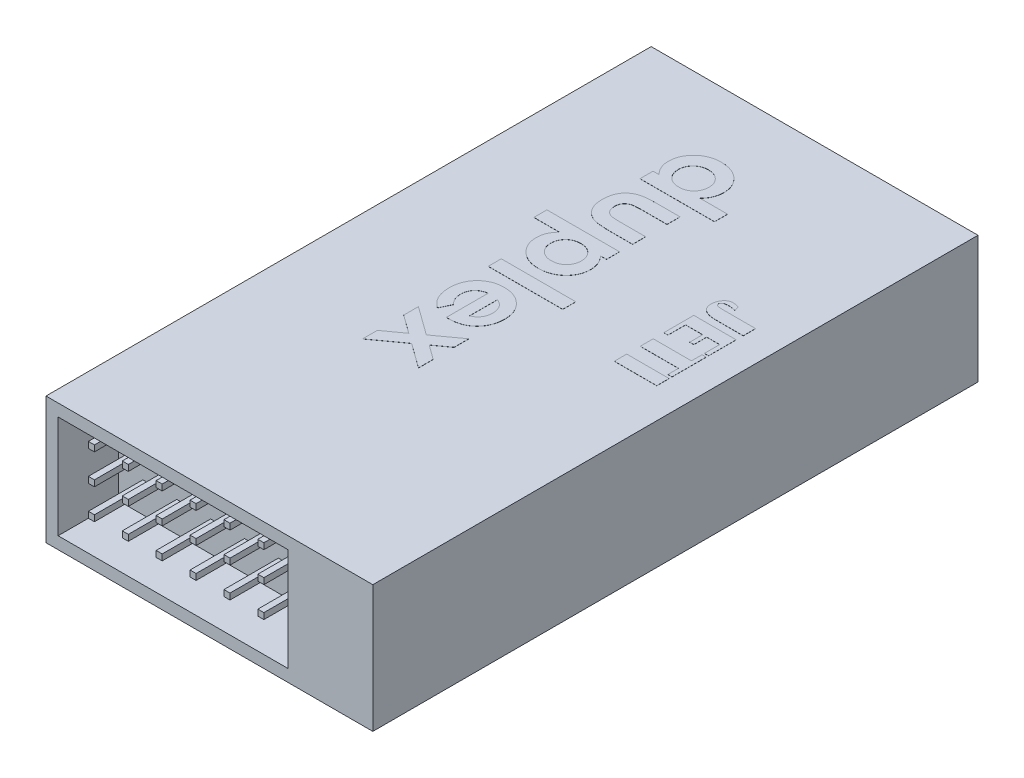
from build123d import *

# Parameters (mm, degrees)
SKETCH1_W                  = 27
SKETCH1_H                  = 50
BOSS_EXTRUDE1_DEPTH        = 10.5
SKETCH2_W                  = 19
SKETCH2_H                  = 8.5
CUT_EXTRUDE1_DEPTH         = 5
SKETCH3_W                  = 0.5
SKETCH3_H                  = 0.5
BOSS_EXTRUDE2_DEPTH        = 4.5
LPATTERN1_COUNT            = 3
LPATTERN1_PITCH            = 2.5
LPATTERN2_COUNT            = 6
LPATTERN2_PITCH            = 2.8
LPATTERN2_COPY_1_SKETCH_W  = 0.5
LPATTERN2_COPY_1_SKETCH_H  = 0.5
LPATTERN2_COPY_1_DEPTH     = 4.5
LPATTERN2_COPY_2_SKETCH_W  = 0.5
LPATTERN2_COPY_2_SKETCH_H  = 0.5
LPATTERN2_COPY_2_DEPTH     = 4.5
LPATTERN2_COPY_3_SKETCH_W  = 0.5
LPATTERN2_COPY_3_SKETCH_H  = 0.5
LPATTERN2_COPY_3_DEPTH     = 4.5
LPATTERN2_COPY_4_SKETCH_W  = 0.5
LPATTERN2_COPY_4_SKETCH_H  = 0.5
LPATTERN2_COPY_4_DEPTH     = 4.5
LPATTERN2_COPY_5_SKETCH_W  = 0.5
LPATTERN2_COPY_5_SKETCH_H  = 0.5
LPATTERN2_COPY_5_DEPTH     = 4.5
LPATTERN2_COPY_6_SKETCH_W  = 0.5
LPATTERN2_COPY_6_SKETCH_H  = 0.5
LPATTERN2_COPY_6_DEPTH     = 4.5
LPATTERN2_COPY_7_SKETCH_W  = 0.5
LPATTERN2_COPY_7_SKETCH_H  = 0.5
LPATTERN2_COPY_7_DEPTH     = 4.5
LPATTERN2_COPY_8_SKETCH_W  = 0.5
LPATTERN2_COPY_8_SKETCH_H  = 0.5
LPATTERN2_COPY_8_DEPTH     = 4.5
LPATTERN2_COPY_9_SKETCH_W  = 0.5
LPATTERN2_COPY_9_SKETCH_H  = 0.5
LPATTERN2_COPY_9_DEPTH     = 4.5
LPATTERN2_COPY_10_SKETCH_W = 0.5
LPATTERN2_COPY_10_SKETCH_H = 0.5
LPATTERN2_COPY_10_DEPTH    = 4.5
SKETCH4_W                  = 25
SKETCH4_H                  = 8.5
CUT_EXTRUDE2_DEPTH         = 5
SKETCH5_W                  = 0.5
SKETCH5_H                  = 0.5
BOSS_EXTRUDE3_DEPTH        = 4.5
LPATTERN3_COUNT            = 3
LPATTERN3_PITCH            = 2.2
LPATTERN4_COUNT            = 8
LPATTERN4_PITCH            = 3
LPATTERN4_COPY_1_SKETCH_W  = 0.5
LPATTERN4_COPY_1_SKETCH_H  = 0.5
LPATTERN4_COPY_1_DEPTH     = 4.5
LPATTERN4_COPY_2_SKETCH_W  = 0.5
LPATTERN4_COPY_2_SKETCH_H  = 0.5
LPATTERN4_COPY_2_DEPTH     = 4.5
LPATTERN4_COPY_3_SKETCH_W  = 0.5
LPATTERN4_COPY_3_SKETCH_H  = 0.5
LPATTERN4_COPY_3_DEPTH     = 4.5
LPATTERN4_COPY_4_SKETCH_W  = 0.5
LPATTERN4_COPY_4_SKETCH_H  = 0.5
LPATTERN4_COPY_4_DEPTH     = 4.5
LPATTERN4_COPY_5_SKETCH_W  = 0.5
LPATTERN4_COPY_5_SKETCH_H  = 0.5
LPATTERN4_COPY_5_DEPTH     = 4.5
LPATTERN4_COPY_6_SKETCH_W  = 0.5
LPATTERN4_COPY_6_SKETCH_H  = 0.5
LPATTERN4_COPY_6_DEPTH     = 4.5
LPATTERN4_COPY_7_SKETCH_W  = 0.5
LPATTERN4_COPY_7_SKETCH_H  = 0.5
LPATTERN4_COPY_7_DEPTH     = 4.5
LPATTERN4_COPY_8_SKETCH_W  = 0.5
LPATTERN4_COPY_8_SKETCH_H  = 0.5
LPATTERN4_COPY_8_DEPTH     = 4.5
LPATTERN4_COPY_9_SKETCH_W  = 0.5
LPATTERN4_COPY_9_SKETCH_H  = 0.5
LPATTERN4_COPY_9_DEPTH     = 4.5
LPATTERN4_COPY_10_SKETCH_W = 0.5
LPATTERN4_COPY_10_SKETCH_H = 0.5
LPATTERN4_COPY_10_DEPTH    = 4.5
LPATTERN4_COPY_11_SKETCH_W = 0.5
LPATTERN4_COPY_11_SKETCH_H = 0.5
LPATTERN4_COPY_11_DEPTH    = 4.5
LPATTERN4_COPY_12_SKETCH_W = 0.5
LPATTERN4_COPY_12_SKETCH_H = 0.5
LPATTERN4_COPY_12_DEPTH    = 4.5
LPATTERN4_COPY_13_SKETCH_W = 0.5
LPATTERN4_COPY_13_SKETCH_H = 0.5
LPATTERN4_COPY_13_DEPTH    = 4.5
LPATTERN4_COPY_14_SKETCH_W = 0.5
LPATTERN4_COPY_14_SKETCH_H = 0.5
LPATTERN4_COPY_14_DEPTH    = 4.5
SKETCH6_W                  = 6.153846154
SKETCH6_H                  = 1.076923077
SKETCH6_W_2                = 3.5
SKETCH6_H_2                = 1.020833333
BOSS_EXTRUDE4_DEPTH        = 0.01


with BuildPart() as part:
    # Sketch1 → Boss-Extrude1 (new body)
    with BuildSketch(Plane(origin=(0, 0, 0), x_dir=(1, 0, 0), z_dir=(0, 1, 0))):
        with Locations((-2.99132948, -15.505780347)):
            Rectangle(SKETCH1_W, SKETCH1_H)
    extrude(amount=BOSS_EXTRUDE1_DEPTH)

    # Sketch2 → Cut-Extrude1 (cut)
    with BuildSketch(Plane.XY.offset(40.505780347)):
        with Locations((-5.99132948, 5.25)):
            Rectangle(SKETCH2_W, SKETCH2_H)
    extrude(amount=-CUT_EXTRUDE1_DEPTH, mode=Mode.SUBTRACT)

    # Sketch3 → Boss-Extrude2 (add)
    with BuildSketch(Plane.XY.offset(35.505780347)):
        with Locations((-13.24132948, 8.25)):
            Rectangle(SKETCH3_W, SKETCH3_H)
    boss_extrude2 = extrude(amount=BOSS_EXTRUDE2_DEPTH)

    # LPattern1: Boss-Extrude2 ×3
    with Locations(*[(0, -i * LPATTERN1_PITCH, 0) for i in range(1, LPATTERN1_COUNT)]):
        add(boss_extrude2)

    # LPattern2: Boss-Extrude2 ×6
    with Locations(*[(i * LPATTERN2_PITCH, 0, 0) for i in range(1, LPATTERN2_COUNT)]):
        add(boss_extrude2)

    # LPattern2 copy 1 sketch → LPattern2 copy 1 (add)
    with BuildSketch(Plane(origin=(2.8, -2.5, 35.505780347), x_dir=(1, 0, 0), z_dir=(0, 0, 1))):
        with Locations((-13.24132948, 8.25)):
            Rectangle(LPATTERN2_COPY_1_SKETCH_W, LPATTERN2_COPY_1_SKETCH_H)
    extrude(amount=LPATTERN2_COPY_1_DEPTH)

    # LPattern2 copy 2 sketch → LPattern2 copy 2 (add)
    with BuildSketch(Plane(origin=(5.6, -2.5, 35.505780347), x_dir=(1, 0, 0), z_dir=(0, 0, 1))):
        with Locations((-13.24132948, 8.25)):
            Rectangle(LPATTERN2_COPY_2_SKETCH_W, LPATTERN2_COPY_2_SKETCH_H)
    extrude(amount=LPATTERN2_COPY_2_DEPTH)

    # LPattern2 copy 3 sketch → LPattern2 copy 3 (add)
    with BuildSketch(Plane(origin=(8.4, -2.5, 35.505780347), x_dir=(1, 0, 0), z_dir=(0, 0, 1))):
        with Locations((-13.24132948, 8.25)):
            Rectangle(LPATTERN2_COPY_3_SKETCH_W, LPATTERN2_COPY_3_SKETCH_H)
    extrude(amount=LPATTERN2_COPY_3_DEPTH)

    # LPattern2 copy 4 sketch → LPattern2 copy 4 (add)
    with BuildSketch(Plane(origin=(11.2, -2.5, 35.505780347), x_dir=(1, 0, 0), z_dir=(0, 0, 1))):
        with Locations((-13.24132948, 8.25)):
            Rectangle(LPATTERN2_COPY_4_SKETCH_W, LPATTERN2_COPY_4_SKETCH_H)
    extrude(amount=LPATTERN2_COPY_4_DEPTH)

    # LPattern2 copy 5 sketch → LPattern2 copy 5 (add)
    with BuildSketch(Plane(origin=(14, -2.5, 35.505780347), x_dir=(1, 0, 0), z_dir=(0, 0, 1))):
        with Locations((-13.24132948, 8.25)):
            Rectangle(LPATTERN2_COPY_5_SKETCH_W, LPATTERN2_COPY_5_SKETCH_H)
    extrude(amount=LPATTERN2_COPY_5_DEPTH)

    # LPattern2 copy 6 sketch → LPattern2 copy 6 (add)
    with BuildSketch(Plane(origin=(2.8, -5, 35.505780347), x_dir=(1, 0, 0), z_dir=(0, 0, 1))):
        with Locations((-13.24132948, 8.25)):
            Rectangle(LPATTERN2_COPY_6_SKETCH_W, LPATTERN2_COPY_6_SKETCH_H)
    extrude(amount=LPATTERN2_COPY_6_DEPTH)

    # LPattern2 copy 7 sketch → LPattern2 copy 7 (add)
    with BuildSketch(Plane(origin=(5.6, -5, 35.505780347), x_dir=(1, 0, 0), z_dir=(0, 0, 1))):
        with Locations((-13.24132948, 8.25)):
            Rectangle(LPATTERN2_COPY_7_SKETCH_W, LPATTERN2_COPY_7_SKETCH_H)
    extrude(amount=LPATTERN2_COPY_7_DEPTH)

    # LPattern2 copy 8 sketch → LPattern2 copy 8 (add)
    with BuildSketch(Plane(origin=(8.4, -5, 35.505780347), x_dir=(1, 0, 0), z_dir=(0, 0, 1))):
        with Locations((-13.24132948, 8.25)):
            Rectangle(LPATTERN2_COPY_8_SKETCH_W, LPATTERN2_COPY_8_SKETCH_H)
    extrude(amount=LPATTERN2_COPY_8_DEPTH)

    # LPattern2 copy 9 sketch → LPattern2 copy 9 (add)
    with BuildSketch(Plane(origin=(11.2, -5, 35.505780347), x_dir=(1, 0, 0), z_dir=(0, 0, 1))):
        with Locations((-13.24132948, 8.25)):
            Rectangle(LPATTERN2_COPY_9_SKETCH_W, LPATTERN2_COPY_9_SKETCH_H)
    extrude(amount=LPATTERN2_COPY_9_DEPTH)

    # LPattern2 copy 10 sketch → LPattern2 copy 10 (add)
    with BuildSketch(Plane(origin=(14, -5, 35.505780347), x_dir=(1, 0, 0), z_dir=(0, 0, 1))):
        with Locations((-13.24132948, 8.25)):
            Rectangle(LPATTERN2_COPY_10_SKETCH_W, LPATTERN2_COPY_10_SKETCH_H)
    extrude(amount=LPATTERN2_COPY_10_DEPTH)

    # Sketch4 → Cut-Extrude2 (cut)
    with BuildSketch(Plane(origin=(0, 0, -9.494219653), x_dir=(-1, 0, 0), z_dir=(0, 0, -1))):
        with Locations((2.99132948, 5.25)):
            Rectangle(SKETCH4_W, SKETCH4_H)
    extrude(amount=-CUT_EXTRUDE2_DEPTH, mode=Mode.SUBTRACT)

    # Sketch5 → Boss-Extrude3 (add)
    with BuildSketch(Plane(origin=(0, 0, -4.494219653), x_dir=(-1, 0, 0), z_dir=(0, 0, -1))):
        with Locations((-7.75867052, 7.45)):
            Rectangle(SKETCH5_W, SKETCH5_H)
    boss_extrude3 = extrude(amount=BOSS_EXTRUDE3_DEPTH)

    # LPattern3: Boss-Extrude3 ×3
    with Locations(*[(0, -i * LPATTERN3_PITCH, 0) for i in range(1, LPATTERN3_COUNT)]):
        add(boss_extrude3)

    # LPattern4: Boss-Extrude3 ×8
    with Locations(*[(-i * LPATTERN4_PITCH, 0, 0) for i in range(1, LPATTERN4_COUNT)]):
        add(boss_extrude3)

    # LPattern4 copy 1 sketch → LPattern4 copy 1 (add)
    with BuildSketch(Plane(origin=(-3, -2.2, -4.494219653), x_dir=(-1, 0, 0), z_dir=(0, 0, -1))):
        with Locations((-7.75867052, 7.45)):
            Rectangle(LPATTERN4_COPY_1_SKETCH_W, LPATTERN4_COPY_1_SKETCH_H)
    extrude(amount=LPATTERN4_COPY_1_DEPTH)

    # LPattern4 copy 2 sketch → LPattern4 copy 2 (add)
    with BuildSketch(Plane(origin=(-6, -2.2, -4.494219653), x_dir=(-1, 0, 0), z_dir=(0, 0, -1))):
        with Locations((-7.75867052, 7.45)):
            Rectangle(LPATTERN4_COPY_2_SKETCH_W, LPATTERN4_COPY_2_SKETCH_H)
    extrude(amount=LPATTERN4_COPY_2_DEPTH)

    # LPattern4 copy 3 sketch → LPattern4 copy 3 (add)
    with BuildSketch(Plane(origin=(-9, -2.2, -4.494219653), x_dir=(-1, 0, 0), z_dir=(0, 0, -1))):
        with Locations((-7.75867052, 7.45)):
            Rectangle(LPATTERN4_COPY_3_SKETCH_W, LPATTERN4_COPY_3_SKETCH_H)
    extrude(amount=LPATTERN4_COPY_3_DEPTH)

    # LPattern4 copy 4 sketch → LPattern4 copy 4 (add)
    with BuildSketch(Plane(origin=(-12, -2.2, -4.494219653), x_dir=(-1, 0, 0), z_dir=(0, 0, -1))):
        with Locations((-7.75867052, 7.45)):
            Rectangle(LPATTERN4_COPY_4_SKETCH_W, LPATTERN4_COPY_4_SKETCH_H)
    extrude(amount=LPATTERN4_COPY_4_DEPTH)

    # LPattern4 copy 5 sketch → LPattern4 copy 5 (add)
    with BuildSketch(Plane(origin=(-15, -2.2, -4.494219653), x_dir=(-1, 0, 0), z_dir=(0, 0, -1))):
        with Locations((-7.75867052, 7.45)):
            Rectangle(LPATTERN4_COPY_5_SKETCH_W, LPATTERN4_COPY_5_SKETCH_H)
    extrude(amount=LPATTERN4_COPY_5_DEPTH)

    # LPattern4 copy 6 sketch → LPattern4 copy 6 (add)
    with BuildSketch(Plane(origin=(-18, -2.2, -4.494219653), x_dir=(-1, 0, 0), z_dir=(0, 0, -1))):
        with Locations((-7.75867052, 7.45)):
            Rectangle(LPATTERN4_COPY_6_SKETCH_W, LPATTERN4_COPY_6_SKETCH_H)
    extrude(amount=LPATTERN4_COPY_6_DEPTH)

    # LPattern4 copy 7 sketch → LPattern4 copy 7 (add)
    with BuildSketch(Plane(origin=(-21, -2.2, -4.494219653), x_dir=(-1, 0, 0), z_dir=(0, 0, -1))):
        with Locations((-7.75867052, 7.45)):
            Rectangle(LPATTERN4_COPY_7_SKETCH_W, LPATTERN4_COPY_7_SKETCH_H)
    extrude(amount=LPATTERN4_COPY_7_DEPTH)

    # LPattern4 copy 8 sketch → LPattern4 copy 8 (add)
    with BuildSketch(Plane(origin=(-3, -4.4, -4.494219653), x_dir=(-1, 0, 0), z_dir=(0, 0, -1))):
        with Locations((-7.75867052, 7.45)):
            Rectangle(LPATTERN4_COPY_8_SKETCH_W, LPATTERN4_COPY_8_SKETCH_H)
    extrude(amount=LPATTERN4_COPY_8_DEPTH)

    # LPattern4 copy 9 sketch → LPattern4 copy 9 (add)
    with BuildSketch(Plane(origin=(-6, -4.4, -4.494219653), x_dir=(-1, 0, 0), z_dir=(0, 0, -1))):
        with Locations((-7.75867052, 7.45)):
            Rectangle(LPATTERN4_COPY_9_SKETCH_W, LPATTERN4_COPY_9_SKETCH_H)
    extrude(amount=LPATTERN4_COPY_9_DEPTH)

    # LPattern4 copy 10 sketch → LPattern4 copy 10 (add)
    with BuildSketch(Plane(origin=(-9, -4.4, -4.494219653), x_dir=(-1, 0, 0), z_dir=(0, 0, -1))):
        with Locations((-7.75867052, 7.45)):
            Rectangle(LPATTERN4_COPY_10_SKETCH_W, LPATTERN4_COPY_10_SKETCH_H)
    extrude(amount=LPATTERN4_COPY_10_DEPTH)

    # LPattern4 copy 11 sketch → LPattern4 copy 11 (add)
    with BuildSketch(Plane(origin=(-12, -4.4, -4.494219653), x_dir=(-1, 0, 0), z_dir=(0, 0, -1))):
        with Locations((-7.75867052, 7.45)):
            Rectangle(LPATTERN4_COPY_11_SKETCH_W, LPATTERN4_COPY_11_SKETCH_H)
    extrude(amount=LPATTERN4_COPY_11_DEPTH)

    # LPattern4 copy 12 sketch → LPattern4 copy 12 (add)
    with BuildSketch(Plane(origin=(-15, -4.4, -4.494219653), x_dir=(-1, 0, 0), z_dir=(0, 0, -1))):
        with Locations((-7.75867052, 7.45)):
            Rectangle(LPATTERN4_COPY_12_SKETCH_W, LPATTERN4_COPY_12_SKETCH_H)
    extrude(amount=LPATTERN4_COPY_12_DEPTH)

    # LPattern4 copy 13 sketch → LPattern4 copy 13 (add)
    with BuildSketch(Plane(origin=(-18, -4.4, -4.494219653), x_dir=(-1, 0, 0), z_dir=(0, 0, -1))):
        with Locations((-7.75867052, 7.45)):
            Rectangle(LPATTERN4_COPY_13_SKETCH_W, LPATTERN4_COPY_13_SKETCH_H)
    extrude(amount=LPATTERN4_COPY_13_DEPTH)

    # LPattern4 copy 14 sketch → LPattern4 copy 14 (add)
    with BuildSketch(Plane(origin=(-21, -4.4, -4.494219653), x_dir=(-1, 0, 0), z_dir=(0, 0, -1))):
        with Locations((-7.75867052, 7.45)):
            Rectangle(LPATTERN4_COPY_14_SKETCH_W, LPATTERN4_COPY_14_SKETCH_H)
    extrude(amount=LPATTERN4_COPY_14_DEPTH)

    # Sketch6 → Boss-Extrude4 (add)
    # profile 1 of 10: a face of its own
    with BuildSketch(Plane(origin=(0, 10.5, 0), x_dir=(1, 0, 0), z_dir=(0, 1, 0))):
        with BuildLine():
            Line((-1.337483326, 0.648065807), (-1.337483326, -0.42885727))
            Line((-1.337483326, -0.42885727), (-7.49132948, -0.42885727))
            Line((-7.49132948, -0.42885727), (-7.49132948, 0.648065807))
            Line((-7.49132948, 0.648065807), (-7.012964095, 0.648065807))
            add(Edge.make_bspline(
                [(-7.012964095, 0.648065807), (-7.059522199, 0.701429359), (-7.149882283, 0.804997475), (-7.267215353, 0.968147007), (-7.363491362, 1.131608486), (-7.441489881, 1.296119683), (-7.497515462, 1.465176564), (-7.539033115, 1.639189064), (-7.5632535, 1.820461575), (-7.566568847, 1.943668066), (-7.568252557, 2.006238884)],
                knots=[0, 0, 0, 0, 1.129160586, 2.191477711, 3.199794721, 4.151823543, 5.089502826, 6.035032201, 7.00208469, 8, 8, 8, 8], degree=3))
            add(Edge.make_bspline(
                [(-7.568252557, 2.006238884), (-7.566672271, 2.076479258), (-7.563549538, 2.215278218), (-7.530681077, 2.418951607), (-7.480361382, 2.615613363), (-7.409178952, 2.805128392), (-7.316843836, 2.98705951), (-7.206369732, 3.162885793), (-7.072070341, 3.328547648), (-6.92239617, 3.48763318), (-6.756604213, 3.632915754), (-6.579427684, 3.761708786), (-6.390761148, 3.868736224), (-6.19304601, 3.956714357), (-5.985804733, 4.025818842), (-5.768492716, 4.07510616), (-5.54100166, 4.104179527), (-5.386044835, 4.107778506), (-5.307435249, 4.109604269)],
                knots=[0, 0, 0, 0, 0.980545136, 1.937612761, 2.874348888, 3.813122963, 4.759326438, 5.720509799, 6.70829705, 7.733758992, 8.768951258, 9.783355028, 10.788637727, 11.793421666, 12.80232853, 13.835642703, 14.90202171, 16, 16, 16, 16], degree=3))
            add(Edge.make_bspline(
                [(-5.307435249, 4.109604269), (-5.226034467, 4.107688904), (-5.066357764, 4.103931704), (-4.832045727, 4.076429915), (-4.609322311, 4.02809166), (-4.397983392, 3.962018546), (-4.197437474, 3.877522137), (-4.008941883, 3.772505389), (-3.830804269, 3.649582393), (-3.667464456, 3.507540711), (-3.518350165, 3.354201668), (-3.386707053, 3.191146163), (-3.277618276, 3.018330991), (-3.186087354, 2.838498402), (-3.116698853, 2.649867618), (-3.065554254, 2.453572925), (-3.034942168, 2.24879344), (-3.031522328, 2.10930664), (-3.029791018, 2.038690807)],
                knots=[0, 0, 0, 0, 1.136421085, 2.229216585, 3.287981067, 4.314102594, 5.316702899, 6.320753391, 7.321604446, 8.333029371, 9.337827526, 10.304906535, 11.253050047, 12.186157492, 13.117149921, 14.053303955, 15.014476191, 16, 16, 16, 16], degree=3))
            add(Edge.make_bspline(
                [(-3.029791018, 2.038690807), (-3.031865058, 1.973319), (-3.035966473, 1.844046249), (-3.061783855, 1.653088128), (-3.110395733, 1.469350149), (-3.173028565, 1.290600821), (-3.257310992, 1.119161545), (-3.358554365, 0.954111257), (-3.478044447, 0.795015075), (-3.570447951, 0.697668143), (-3.617531403, 0.648065807)],
                knots=[0, 0, 0, 0, 1.011899165, 2.001030639, 2.974036179, 3.948778736, 4.92769327, 5.924124564, 6.942254589, 8, 8, 8, 8], degree=3))
            Line((-3.617531403, 0.648065807), (-1.337483326, 0.648065807))
        make_face()
        with BuildLine():
            add(Edge.make_bspline(
                [(-4.029791018, 1.812729269), (-4.031107713, 1.855641479), (-4.033688349, 1.939746608), (-4.049211052, 2.063434712), (-4.076562748, 2.181643433), (-4.116969005, 2.293529718), (-4.166189713, 2.400761083), (-4.22783784, 2.501709204), (-4.300704615, 2.597207234), (-4.383025937, 2.68669354), (-4.47351212, 2.768273494), (-4.572252151, 2.838600175), (-4.676585547, 2.898366492), (-4.786826002, 2.948913263), (-4.904278003, 2.985093283), (-5.027412532, 3.013747844), (-5.157235536, 3.028617707), (-5.245705896, 3.031313144), (-5.290608326, 3.032681192)],
                knots=[0, 0, 0, 0, 1.04836806, 2.054732945, 3.03993516, 4.00574415, 4.955904794, 5.917688631, 6.888591924, 7.88601754, 8.884115178, 9.859153345, 10.841239365, 11.818093293, 12.814750328, 13.83810466, 14.90274714, 16, 16, 16, 16], degree=3))
            add(Edge.make_bspline(
                [(-5.290608326, 3.032681192), (-5.335918394, 3.031334648), (-5.425201359, 3.028681298), (-5.556114518, 3.013500566), (-5.681065626, 2.98590835), (-5.798939405, 2.945493905), (-5.911893352, 2.89660912), (-6.017787957, 2.835039554), (-6.11697438, 2.761745044), (-6.210337881, 2.680045278), (-6.293128052, 2.588733365), (-6.368454475, 2.493613693), (-6.428743331, 2.390954559), (-6.480264978, 2.284300142), (-6.519836167, 2.17267949), (-6.547598375, 2.055413126), (-6.564587677, 1.933419399), (-6.567022494, 1.850043048), (-6.568252557, 1.807921576)],
                knots=[0, 0, 0, 0, 1.099386164, 2.166327687, 3.192099357, 4.19717067, 5.185034887, 6.173616074, 7.161193358, 8.17338296, 9.177655011, 10.147763629, 11.111227589, 12.058972978, 13.018112925, 13.97759754, 14.978288615, 16, 16, 16, 16], degree=3))
            add(Edge.make_bspline(
                [(-6.568252557, 1.807921576), (-6.566928442, 1.764210114), (-6.564332457, 1.678511886), (-6.548951956, 1.552805339), (-6.521498006, 1.433010593), (-6.480867561, 1.319614587), (-6.431973803, 1.210927505), (-6.371628749, 1.107774055), (-6.298375199, 1.0116273), (-6.216697624, 0.920216896), (-6.123632751, 0.839478937), (-6.025360072, 0.766155229), (-5.918434152, 0.706057045), (-5.805199284, 0.656752734), (-5.685235691, 0.618113833), (-5.558527808, 0.590243129), (-5.424788357, 0.575117261), (-5.333511856, 0.572484324), (-5.287002557, 0.57114273)],
                knots=[0, 0, 0, 0, 1.049905731, 2.058385982, 3.036337956, 3.994927362, 4.946537361, 5.895419282, 6.857623746, 7.845325573, 8.833777008, 9.811444928, 10.78531754, 11.772081556, 12.77319045, 13.807459548, 14.882806445, 16, 16, 16, 16], degree=3))
            add(Edge.make_bspline(
                [(-5.287002557, 0.57114273), (-5.241293209, 0.572467653), (-5.152009576, 0.575055613), (-5.02106239, 0.59030863), (-4.896843218, 0.618376356), (-4.77897123, 0.656218182), (-4.668449712, 0.706376188), (-4.564080821, 0.766544947), (-4.467195459, 0.839073039), (-4.376503533, 0.920697613), (-4.295970557, 1.011584223), (-4.223672708, 1.108305585), (-4.164184425, 1.211965493), (-4.113798285, 1.320606842), (-4.077326331, 1.435973621), (-4.048986057, 1.55595787), (-4.033699205, 1.682532945), (-4.031115006, 1.768622275), (-4.029791018, 1.812729269)],
                knots=[0, 0, 0, 0, 1.106469885, 2.16125711, 3.184599668, 4.184238692, 5.152050012, 6.116650044, 7.094080022, 8.075733422, 9.064591803, 10.028460505, 10.993060537, 11.952039452, 12.921015874, 13.915988178, 14.932277727, 16, 16, 16, 16], degree=3))
        make_face(mode=Mode.SUBTRACT)
    # profile 2 of 10: a face of its own
    with BuildSketch(Plane(origin=(0, 10.5, 0), x_dir=(1, 0, 0), z_dir=(0, 1, 0))):
        with BuildLine():
            Line((-3.106714095, -1.505780347), (-3.106714095, -2.582703424))
            Line((-3.106714095, -2.582703424), (-5.211281403, -2.582703424))
            add(Edge.make_bspline(
                [(-5.211281403, -2.582703424), (-5.260565289, -2.582799055), (-5.355153103, -2.582982595), (-5.490999719, -2.588089912), (-5.615225237, -2.59525648), (-5.727976106, -2.604199896), (-5.828981237, -2.617548439), (-5.918047447, -2.632958995), (-5.995817593, -2.650428901), (-6.082499499, -2.678840033), (-6.177375813, -2.723273296), (-6.278014588, -2.790447341), (-6.365568451, -2.871777784), (-6.439020243, -2.967190927), (-6.497640721, -3.075389235), (-6.537720392, -3.195860563), (-6.564110895, -3.327558574), (-6.566835618, -3.41950427), (-6.568252557, -3.467318808)],
                knots=[0, 0, 0, 0, 1.267467482, 2.432579623, 3.495718977, 4.46782216, 5.340771086, 6.114964255, 6.792308577, 7.388622481, 8.458084915, 9.475498183, 10.488937983, 11.51740562, 12.559360757, 13.637967653, 14.771671862, 16, 16, 16, 16], degree=3))
            add(Edge.make_bspline(
                [(-6.568252557, -3.467318808), (-6.566650401, -3.51509462), (-6.5635588, -3.607285251), (-6.539449674, -3.740185213), (-6.498137884, -3.861460219), (-6.442103316, -3.972355844), (-6.367110592, -4.069601768), (-6.27775144, -4.154269817), (-6.172584388, -4.225558327), (-6.094132781, -4.259815744), (-6.05382948, -4.277414962)],
                knots=[0, 0, 0, 0, 1.116871431, 2.155171802, 3.144773418, 4.104381479, 5.046960687, 6.001340237, 6.973219418, 8, 8, 8, 8], degree=3))
            add(Edge.make_bspline(
                [(-6.05382948, -4.277414962), (-6.035926946, -4.283878693), (-5.996409167, -4.298146633), (-5.928222117, -4.310724108), (-5.847918117, -4.324914446), (-5.753407286, -4.333193698), (-5.646096167, -4.342046693), (-5.525031617, -4.347730098), (-5.390791838, -4.351335353), (-5.296620911, -4.351728467), (-5.247339095, -4.351934193)],
                knots=[0, 0, 0, 0, 0.56097549, 1.238288705, 2.041265676, 2.968564175, 4.036154886, 5.220272437, 6.545304513, 8, 8, 8, 8], degree=3))
            Line((-5.247339095, -4.351934193), (-3.106714095, -4.351934193))
            Line((-3.106714095, -4.351934193), (-3.106714095, -5.42885727))
            Line((-3.106714095, -5.42885727), (-4.949262172, -5.42885727))
            add(Edge.make_bspline(
                [(-4.949262172, -5.42885727), (-5.040621703, -5.428690343), (-5.215785575, -5.428370294), (-5.467019379, -5.417868534), (-5.695594503, -5.404568663), (-5.901548467, -5.383649744), (-6.086025123, -5.359930218), (-6.247524532, -5.327164868), (-6.387705676, -5.291650812), (-6.470752685, -5.258958586), (-6.509358326, -5.243761116)],
                knots=[0, 0, 0, 0, 1.388116509, 2.661439483, 3.820463473, 4.866642689, 5.806839029, 6.644994921, 7.370105668, 8, 8, 8, 8], degree=3))
            add(Edge.make_bspline(
                [(-6.509358326, -5.243761116), (-6.550912618, -5.224291939), (-6.63293722, -5.185861455), (-6.749527278, -5.119143437), (-6.860106462, -5.047348538), (-6.961298004, -4.966623244), (-7.056658637, -4.880482428), (-7.143933976, -4.787222974), (-7.223280415, -4.686730659), (-7.296637325, -4.580713897), (-7.35924036, -4.466023821), (-7.417114134, -4.34559438), (-7.463182905, -4.216407553), (-7.501796902, -4.080296775), (-7.531722006, -3.936498083), (-7.55339709, -3.785591608), (-7.565003709, -3.626954937), (-7.567151863, -3.519018577), (-7.568252557, -3.463713039)],
                knots=[0, 0, 0, 0, 0.997222436, 1.96843142, 2.917797601, 3.860467999, 4.779133207, 5.709613475, 6.633219993, 7.560883278, 8.508369802, 9.470751391, 10.462672762, 11.485580885, 12.544670258, 13.653244457, 14.797545346, 16, 16, 16, 16], degree=3))
            add(Edge.make_bspline(
                [(-7.568252557, -3.463713039), (-7.567540569, -3.403969314), (-7.566147451, -3.287071103), (-7.549087212, -3.116284449), (-7.527013481, -2.953522472), (-7.489484093, -2.8006024), (-7.446004419, -2.655388631), (-7.390512789, -2.519548302), (-7.325270356, -2.392526336), (-7.250663913, -2.274072799), (-7.16600977, -2.165106375), (-7.074967186, -2.063204073), (-6.973913866, -1.971655736), (-6.865970376, -1.887472685), (-6.750143259, -1.81159445), (-6.62684436, -1.743983369), (-6.495512856, -1.684582173), (-6.403468223, -1.652888688), (-6.356714095, -1.636789962)],
                knots=[0, 0, 0, 0, 1.211240017, 2.369985978, 3.478996442, 4.539426614, 5.559871561, 6.551301256, 7.510778031, 8.453136967, 9.386094087, 10.30661716, 11.221130616, 12.147659962, 13.080758632, 14.026335491, 14.997475882, 16, 16, 16, 16], degree=3))
            add(Edge.make_bspline(
                [(-6.356714095, -1.636789962), (-6.320403049, -1.625806887), (-6.242180592, -1.602146782), (-6.112183998, -1.576601118), (-5.962355645, -1.556168767), (-5.792548155, -1.536292822), (-5.602476846, -1.522427), (-5.392443577, -1.513364133), (-5.162037627, -1.507240635), (-5.001750388, -1.50628145), (-4.918012172, -1.505780347)],
                knots=[0, 0, 0, 0, 0.627914866, 1.352675004, 2.190563461, 3.132055958, 4.183353232, 5.345633452, 6.613289997, 8, 8, 8, 8], degree=3))
            Line((-4.918012172, -1.505780347), (-3.106714095, -1.505780347))
        make_face()
    # profile 3 of 10: a face of its own
    with BuildSketch(Plane(origin=(0, 10.5, 0), x_dir=(1, 0, 0), z_dir=(0, 1, 0))):
        with BuildLine():
            Line((-3.106714095, -7.582703424), (-3.60070448, -7.582703424))
            add(Edge.make_bspline(
                [(-3.60070448, -7.582703424), (-3.554767285, -7.632699891), (-3.464551375, -7.730887794), (-3.349065391, -7.891653876), (-3.249814066, -8.056842543), (-3.170383141, -8.22925067), (-3.106735598, -8.406800002), (-3.063386165, -8.591119765), (-3.033717504, -8.781263949), (-3.031111922, -8.910311431), (-3.029791018, -8.97573227)],
                knots=[0, 0, 0, 0, 1.054345398, 2.070625563, 3.070134531, 4.045138923, 5.016019057, 5.996139535, 6.984139557, 8, 8, 8, 8], degree=3))
            add(Edge.make_bspline(
                [(-3.029791018, -8.97573227), (-3.031482628, -9.046355711), (-3.034814549, -9.185460974), (-3.065922827, -9.390127897), (-3.116207208, -9.586264205), (-3.18641794, -9.774617731), (-3.277574739, -9.954185272), (-3.386718204, -10.126983164), (-3.518350271, -10.290036032), (-3.667451714, -10.44340472), (-3.830855132, -10.585329346), (-4.008594024, -10.708576701), (-4.197798738, -10.811903607), (-4.39793317, -10.896747215), (-4.609336361, -10.962703805), (-4.8320418, -11.011074652), (-5.066358805, -11.038567433), (-5.226034819, -11.042325884), (-5.307435249, -11.044241885)],
                knots=[0, 0, 0, 0, 0.986020426, 1.942140297, 2.884184618, 3.810402461, 4.74398011, 5.692601402, 6.660167734, 7.665472218, 8.677406811, 9.678762208, 10.680617953, 11.68372348, 12.710362081, 13.769660087, 14.863006259, 16, 16, 16, 16], degree=3))
            add(Edge.make_bspline(
                [(-5.307435249, -11.044241885), (-5.386045904, -11.042418566), (-5.541004838, -11.038824402), (-5.76848059, -11.009716074), (-5.985848239, -10.960555851), (-6.192734178, -10.89104255), (-6.391053938, -10.804852641), (-6.579432926, -10.697506419), (-6.75621337, -10.568714195), (-6.922721436, -10.424672268), (-7.072502159, -10.265504197), (-7.205590558, -10.098975747), (-7.317261415, -9.923970902), (-7.409082181, -9.742117984), (-7.48062359, -9.552328736), (-7.530345828, -9.355517837), (-7.563669219, -9.151943525), (-7.566709561, -9.013527491), (-7.568252557, -8.943280347)],
                knots=[0, 0, 0, 0, 1.098417511, 2.1652231, 3.198950626, 4.208261081, 5.211182938, 6.216867778, 7.231677337, 8.263598561, 9.289470716, 10.282037912, 11.238882362, 12.185464344, 13.124613954, 14.067146156, 15.019062619, 16, 16, 16, 16], degree=3))
            add(Edge.make_bspline(
                [(-7.568252557, -8.943280347), (-7.566734442, -8.880682792), (-7.563743847, -8.757369376), (-7.537078899, -8.576039869), (-7.49725053, -8.400873505), (-7.437304394, -8.231638576), (-7.357756375, -8.066432578), (-7.258693702, -7.902441848), (-7.137671783, -7.739287178), (-7.044327595, -7.636017855), (-6.996137172, -7.582703424)],
                knots=[0, 0, 0, 0, 0.990856396, 1.951927477, 2.896945079, 3.83213376, 4.788585491, 5.796263726, 6.862286081, 8, 8, 8, 8], degree=3))
            Line((-6.996137172, -7.582703424), (-9.106714095, -7.582703424))
            Line((-9.106714095, -7.582703424), (-9.106714095, -6.505780347))
            Line((-9.106714095, -6.505780347), (-3.106714095, -6.505780347))
            Line((-3.106714095, -6.505780347), (-3.106714095, -7.582703424))
        make_face()
        with BuildLine():
            add(Edge.make_bspline(
                [(-4.029791018, -8.742559193), (-4.031134931, -8.698854404), (-4.033769729, -8.613169259), (-4.048870734, -8.487368501), (-4.077280363, -8.36816763), (-4.114111931, -8.253765718), (-4.163792352, -8.145569658), (-4.224147198, -8.042850105), (-4.295442294, -7.946141524), (-4.377429843, -7.856684769), (-4.466259957, -7.77336115), (-4.564921658, -7.702830541), (-4.668002406, -7.640682882), (-4.779043954, -7.590970867), (-4.896822973, -7.552981941), (-5.02106802, -7.524955156), (-5.152008069, -7.509690845), (-5.241292699, -7.507104463), (-5.287002557, -7.505780347)],
                knots=[0, 0, 0, 0, 1.060568847, 2.079291485, 3.067175794, 4.029236509, 4.990511307, 5.949030319, 6.915206611, 7.899210179, 8.889768581, 9.863784456, 10.835615511, 11.805743859, 12.80777611, 13.833568643, 14.890881125, 16, 16, 16, 16], degree=3))
            add(Edge.make_bspline(
                [(-5.287002557, -7.505780347), (-5.333512363, -7.507121122), (-5.42478986, -7.50975245), (-5.558522148, -7.524889888), (-5.685255766, -7.552719028), (-5.805127348, -7.591506533), (-5.918880843, -7.640348668), (-6.024526096, -7.702452917), (-6.124560946, -7.773752161), (-6.215786003, -7.856213844), (-6.298851511, -7.946207331), (-6.371551077, -8.042488386), (-6.431994553, -8.145544628), (-6.480861954, -8.254257742), (-6.521499545, -8.367646689), (-6.548951528, -8.487443378), (-6.564332571, -8.61314939), (-6.56692848, -8.698847693), (-6.568252557, -8.742559193)],
                knots=[0, 0, 0, 0, 1.117303121, 2.19275548, 3.227126012, 4.228333087, 5.215193878, 6.193951608, 7.166063962, 8.161008357, 9.141703709, 10.104002538, 11.052977519, 12.004680845, 12.963364262, 13.941412147, 14.949991302, 16, 16, 16, 16], degree=3))
            add(Edge.make_bspline(
                [(-6.568252557, -8.742559193), (-6.567037883, -8.784685201), (-6.564633527, -8.868070531), (-6.547367862, -8.99038548), (-6.520359921, -9.107892457), (-6.479580005, -9.219440335), (-6.429538137, -9.326427585), (-6.367620943, -9.428494083), (-6.29361922, -9.524532479), (-6.21027533, -9.615854583), (-6.11694105, -9.69750605), (-6.01813692, -9.771093582), (-5.911524903, -9.831002433), (-5.798990034, -9.880220004), (-5.681051671, -9.920521578), (-5.556118436, -9.94814503), (-5.425200328, -9.963317113), (-5.335918047, -9.965971658), (-5.290608326, -9.967318808)],
                knots=[0, 0, 0, 0, 1.021479428, 2.021943319, 2.990662685, 3.940432525, 4.896741647, 5.851667391, 6.829265152, 7.833309205, 8.845269013, 9.832622089, 10.816142259, 11.803782204, 12.808625337, 13.834164129, 14.900863427, 16, 16, 16, 16], degree=3))
            add(Edge.make_bspline(
                [(-5.290608326, -9.967318808), (-5.245705896, -9.965950761), (-5.157235536, -9.963255323), (-5.027412533, -9.948385461), (-4.904277999, -9.919730902), (-4.786826015, -9.883550874), (-4.6765855, -9.833004132), (-4.572252326, -9.773237705), (-4.473511466, -9.702911432), (-4.383028441, -9.621329925), (-4.300695388, -9.53184939), (-4.227871124, -9.436330444), (-4.165876927, -9.335148197), (-4.11698748, -9.226924768), (-4.076762001, -9.114214061), (-4.04905416, -8.995293621), (-4.03371909, -8.870768026), (-4.031117961, -8.785869456), (-4.029791018, -8.742559193)],
                knots=[0, 0, 0, 0, 1.094680664, 2.156827393, 3.177782763, 4.17210342, 5.146667393, 6.126451192, 7.099203661, 8.094961544, 9.09004898, 10.058676268, 11.018205477, 11.974998356, 12.947750825, 13.930643515, 14.944335875, 16, 16, 16, 16], degree=3))
        make_face(mode=Mode.SUBTRACT)
    # profile 4 of 10: a face of its own
    with BuildSketch(Plane(origin=(0, 10.5, 0), x_dir=(1, 0, 0), z_dir=(0, 1, 0))):
        with Locations((-4.414406403, -12.428857269)):
            Rectangle(SKETCH6_W, SKETCH6_H)
    # profile 5 of 10: a face of its own
    with BuildSketch(Plane(origin=(0, 10.5, 0), x_dir=(1, 0, 0), z_dir=(0, 1, 0))):
        with BuildLine():
            Line((-5.568252557, -18.348328424), (-5.568252557, -14.890395731))
            add(Edge.make_bspline(
                [(-5.568252557, -14.890395731), (-5.608431773, -14.897446177), (-5.687387102, -14.911300859), (-5.80207657, -14.941386793), (-5.910157988, -14.979780956), (-6.011775836, -15.025793944), (-6.107467326, -15.078649977), (-6.196783629, -15.14030216), (-6.279645854, -15.209968491), (-6.355693874, -15.287246179), (-6.423834548, -15.370847145), (-6.483530085, -15.460365955), (-6.532476775, -15.555894987), (-6.573733754, -15.656339036), (-6.606413462, -15.76244865), (-6.628952035, -15.874379997), (-6.642265653, -15.991836363), (-6.644191315, -16.071851228), (-6.645175634, -16.112751501)],
                knots=[0, 0, 0, 0, 1.091296461, 2.144483647, 3.168565212, 4.157007626, 5.126487748, 6.090021542, 7.05641414, 8.019231907, 8.98705074, 9.938580405, 10.892824166, 11.854447369, 12.841318655, 13.858982407, 14.905600794, 16, 16, 16, 16], degree=3))
            add(Edge.make_bspline(
                [(-6.645175634, -16.112751501), (-6.643872234, -16.162120907), (-6.641305455, -16.259343807), (-6.618541942, -16.401776079), (-6.584158657, -16.539528833), (-6.533027825, -16.671298445), (-6.469378928, -16.798611256), (-6.390080234, -16.919371308), (-6.29744911, -17.035668863), (-6.226049075, -17.106624076), (-6.189646787, -17.142799578)],
                knots=[0, 0, 0, 0, 1.021034703, 2.010718019, 2.977989445, 3.954245119, 4.929443971, 5.918328161, 6.938689359, 8, 8, 8, 8], degree=3))
            Line((-6.189646787, -17.142799578), (-6.618733326, -18.044241885))
            add(Edge.make_bspline(
                [(-6.618733326, -18.044241885), (-6.657920241, -18.015412734), (-6.735378008, -17.958428364), (-6.84464654, -17.86662446), (-6.947396647, -17.77198834), (-7.041458739, -17.672025708), (-7.126546369, -17.566986034), (-7.205105347, -17.459086653), (-7.275032225, -17.346437016), (-7.337892878, -17.229908765), (-7.392191096, -17.107635121), (-7.438421936, -16.980020777), (-7.480235161, -16.84766975), (-7.51208945, -16.708893185), (-7.537306507, -16.564851516), (-7.55521358, -16.415198816), (-7.566274016, -16.259955186), (-7.56758521, -16.154436981), (-7.568252557, -16.10073227)],
                knots=[0, 0, 0, 0, 1.033338888, 2.04252164, 3.030262006, 3.999752838, 4.955583682, 5.900551376, 6.833481756, 7.770287093, 8.71145193, 9.672837889, 10.652846169, 11.658324827, 12.695268294, 13.758430956, 14.85912751, 16, 16, 16, 16], degree=3))
            add(Edge.make_bspline(
                [(-7.568252557, -16.10073227), (-7.566568106, -16.018108456), (-7.563269205, -15.856294479), (-7.532650692, -15.61961228), (-7.481881886, -15.394829859), (-7.41286953, -15.181312406), (-7.321751464, -14.979983259), (-7.210307002, -14.790741404), (-7.080670531, -14.61170121), (-6.93012978, -14.448313991), (-6.766249873, -14.299519595), (-6.590346334, -14.168623439), (-6.403079718, -14.059749922), (-6.20749625, -13.967672244), (-5.999956979, -13.900170566), (-5.783411933, -13.849219611), (-5.556309609, -13.818536602), (-5.401679505, -13.815179514), (-5.323060249, -13.813472655)],
                knots=[0, 0, 0, 0, 1.103528868, 2.161197684, 3.181904866, 4.17893931, 5.15400521, 6.128071465, 7.108807125, 8.101535823, 9.090664498, 10.062772592, 11.024896103, 11.980490186, 12.945349712, 13.934753549, 14.949957771, 16, 16, 16, 16], degree=3))
            add(Edge.make_bspline(
                [(-5.323060249, -13.813472655), (-5.242438269, -13.815183284), (-5.083818144, -13.81854887), (-4.851541733, -13.849099611), (-4.629895979, -13.899812947), (-4.418681585, -13.969952952), (-4.216664808, -14.058097239), (-4.02725824, -14.170546406), (-3.847492981, -14.300528872), (-3.679834315, -14.448947954), (-3.528442547, -14.612990655), (-3.393474785, -14.78731009), (-3.281440525, -14.973655511), (-3.189955689, -15.169634518), (-3.116504082, -15.374942636), (-3.067331648, -15.591693465), (-3.034374765, -15.818068324), (-3.031335664, -15.972806579), (-3.029791018, -16.051453424)],
                knots=[0, 0, 0, 0, 1.079354094, 2.123580709, 3.131027717, 4.120248802, 5.100347326, 6.076737579, 7.064152558, 8.067633759, 9.069995403, 10.049814825, 11.015114092, 11.975254693, 12.94256508, 13.929104949, 14.947452504, 16, 16, 16, 16], degree=3))
            add(Edge.make_bspline(
                [(-3.029791018, -16.051453424), (-3.031500339, -16.134473631), (-3.034856414, -16.297475251), (-3.065244158, -16.535797831), (-3.11625833, -16.762101703), (-3.185016214, -16.977529345), (-3.277809829, -17.179559492), (-3.386886609, -17.3717196), (-3.519275784, -17.549644669), (-3.669081642, -17.71545603), (-3.835352508, -17.864998063), (-4.015500519, -17.99612434), (-4.209361067, -18.105762246), (-4.415439509, -18.196319498), (-4.634753519, -18.265956093), (-4.866443848, -18.316374354), (-5.111500524, -18.346988431), (-5.279300595, -18.350260555), (-5.365127557, -18.351934193)],
                knots=[0, 0, 0, 0, 1.079855552, 2.120185087, 3.119263157, 4.095157605, 5.056350796, 6.006812003, 6.964961307, 7.935564877, 8.91003822, 9.869321262, 10.82883089, 11.80218819, 12.792963453, 13.817487929, 14.883681165, 16, 16, 16, 16], degree=3))
            Line((-5.365127557, -18.351934193), (-5.568252557, -18.348328424))
        make_face()
        with BuildLine():
            add(Edge.make_bspline(
                [(-4.722098711, -17.275011116), (-4.667180451, -17.254804483), (-4.557791562, -17.214555918), (-4.408562331, -17.121538645), (-4.27701202, -17.002035868), (-4.162210585, -16.860919583), (-4.068480865, -16.700092533), (-4.00072166, -16.524094464), (-3.960067704, -16.335353008), (-3.955301674, -16.205501418), (-3.952867941, -16.139193808)],
                knots=[0, 0, 0, 0, 0.954352776, 1.900926752, 2.851296618, 3.847186113, 4.86225778, 5.87988081, 6.91737917, 8, 8, 8, 8], degree=3))
            add(Edge.make_bspline(
                [(-3.952867941, -16.139193808), (-3.95520636, -16.066775817), (-3.959777481, -15.925213723), (-4.008393035, -15.721020039), (-4.080950297, -15.528409248), (-4.155758375, -15.414856842), (-4.193252557, -15.357943808)],
                knots=[0, 0, 0, 0, 1.044195649, 2.041185066, 3.018232172, 4, 4, 4, 4], degree=3))
            add(Edge.make_bspline(
                [(-4.193252557, -15.357943808), (-4.221808947, -15.322434326), (-4.282689712, -15.246729926), (-4.404141057, -15.148412403), (-4.551191372, -15.051568824), (-4.662886475, -14.996507911), (-4.722098711, -14.967318808)],
                knots=[0, 0, 0, 0, 0.82159062, 1.751589201, 2.808063854, 4, 4, 4, 4], degree=3))
            Line((-4.722098711, -14.967318808), (-4.722098711, -17.275011116))
        make_face(mode=Mode.SUBTRACT)
    # profile 6 of 10: a face of its own
    with BuildSketch(Plane(origin=(0, 10.5, 0), x_dir=(1, 0, 0), z_dir=(0, 1, 0))):
        Polygon((-3.106714095, -18.956501501), (-3.106714095, -20.171645731), (-4.301425634, -21.03823227), (-3.106714095, -21.901213039), (-3.106714095, -23.11635727), (-5.141569864, -21.64760727), (-7.49132948, -23.351934193), (-7.49132948, -22.136789962), (-5.981714095, -21.041838039), (-7.49132948, -19.951693808), (-7.49132948, -18.736549578), (-5.141569864, -20.432463039), align=None)
    # profile 7 of 10: a face of its own
    with BuildSketch(Plane(origin=(0, 10.5, 0), x_dir=(1, 0, 0), z_dir=(0, 1, 0))):
        with BuildLine():
            Line((8.00867052, -7.40161368), (5.753570694, -7.40161368))
            add(Edge.make_bspline(
                [(5.753570694, -7.40161368), (5.699374895, -7.400840427), (5.594418729, -7.399342937), (5.441936335, -7.389098092), (5.300176525, -7.370138673), (5.168777213, -7.344285944), (5.047458665, -7.312441636), (4.937103322, -7.271083493), (4.836722209, -7.223560677), (4.747014096, -7.167725356), (4.66772233, -7.104549701), (4.59824127, -7.034494917), (4.541111231, -6.955537396), (4.492693725, -6.870583006), (4.45610974, -6.777397073), (4.430694501, -6.677083919), (4.414203532, -6.569436152), (4.412384477, -6.495028983), (4.411448298, -6.456735208)],
                knots=[0, 0, 0, 0, 1.393752041, 2.699155183, 3.927560345, 5.06913723, 6.141589892, 7.149041927, 8.095503494, 8.993419382, 9.859784983, 10.697769213, 11.522109356, 12.358802529, 13.206369495, 14.087581505, 15.015770593, 16, 16, 16, 16], degree=3))
            add(Edge.make_bspline(
                [(4.411448298, -6.456735208), (4.412137117, -6.422519985), (4.413493188, -6.355160893), (4.425389804, -6.256422565), (4.443298771, -6.161568474), (4.469263468, -6.070825141), (4.502697693, -5.983820135), (4.544081451, -5.90094986), (4.591724007, -5.821481709), (4.64722736, -5.747675751), (4.707179559, -5.679565514), (4.771682508, -5.619996032), (4.840048096, -5.57034338), (4.910821011, -5.528833468), (4.985042601, -5.496689175), (5.062538539, -5.473755633), (5.143395704, -5.459716106), (5.198537775, -5.458025044), (5.226443958, -5.457169236)],
                knots=[0, 0, 0, 0, 1.146110795, 2.256334405, 3.327860469, 4.377842882, 5.414545414, 6.446550899, 7.478137834, 8.51487508, 9.536471047, 10.515212272, 11.450212695, 12.362576372, 13.259344301, 14.153218126, 15.065384557, 16, 16, 16, 16], degree=3))
            add(Edge.make_bspline(
                [(5.226443958, -5.457169236), (5.262465439, -5.458440483), (5.339251717, -5.461150377), (5.460595481, -5.481937095), (5.59519912, -5.513990804), (5.688410729, -5.542917733), (5.737620173, -5.558189201)],
                knots=[0, 0, 0, 0, 0.826246522, 1.761293332, 2.818113862, 4, 4, 4, 4], degree=3))
            Line((5.737620173, -5.558189201), (5.83788059, -5.929608472))
            add(Edge.make_bspline(
                [(5.83788059, -5.929608472), (5.807524815, -5.922901319), (5.749192885, -5.910012793), (5.664548213, -5.893392703), (5.586554102, -5.879007863), (5.515226595, -5.866617279), (5.450402137, -5.857269839), (5.3920942, -5.851397179), (5.340432436, -5.847258797), (5.308228243, -5.846438688), (5.293284236, -5.846058125)],
                knots=[0, 0, 0, 0, 1.352049489, 2.598110523, 3.751438528, 4.801414202, 5.74667969, 6.599135084, 7.349943785, 8, 8, 8, 8], degree=3))
            add(Edge.make_bspline(
                [(5.293284236, -5.846058125), (5.247159343, -5.846954264), (5.160669669, -5.848634632), (5.04002635, -5.863954936), (4.937545182, -5.890306134), (4.85207916, -5.925623446), (4.784782774, -5.974113312), (4.737655045, -6.034932851), (4.707308966, -6.106242012), (4.704550894, -6.157914602), (4.703114965, -6.184816805)],
                knots=[0, 0, 0, 0, 1.449136064, 2.717302894, 3.811532554, 4.766433551, 5.608234559, 6.384911576, 7.159139531, 8, 8, 8, 8], degree=3))
            add(Edge.make_bspline(
                [(4.703114965, -6.184816805), (4.704939503, -6.200404495), (4.708657924, -6.232172306), (4.73861917, -6.27482895), (4.786298481, -6.308209461), (4.85108388, -6.334635922), (4.932715781, -6.356261692), (5.03234773, -6.370443808), (5.149310786, -6.379362747), (5.233259923, -6.380286835), (5.278093263, -6.380780347)],
                knots=[0, 0, 0, 0, 0.567427893, 1.156421672, 1.838952353, 2.677933308, 3.705993877, 4.925729793, 6.358174874, 8, 8, 8, 8], degree=3))
            Line((5.278093263, -6.380780347), (8.00867052, -6.380780347))
            Line((8.00867052, -6.380780347), (8.00867052, -7.40161368))
        make_face()
    # profile 8 of 10: a face of its own
    with BuildSketch(Plane(origin=(0, 10.5, 0), x_dir=(1, 0, 0), z_dir=(0, 1, 0))):
        Polygon((8.00867052, -10.269669236), (7.668392742, -10.269669236), (7.668392742, -9.005780347), (6.598948298, -9.005780347), (6.598948298, -10.075224791), (6.25867052, -10.075224791), (6.25867052, -9.005780347), (4.848948298, -9.005780347), (4.848948298, -10.46411368), (4.50867052, -10.46411368), (4.50867052, -7.984947013), (8.00867052, -7.984947013), align=None)
    # profile 9 of 10: a face of its own
    with BuildSketch(Plane(origin=(0, 10.5, 0), x_dir=(1, 0, 0), z_dir=(0, 1, 0))):
        Polygon((8.00867052, -13.283558125), (7.668392742, -13.283558125), (7.668392742, -12.408558125), (4.50867052, -12.408558125), (4.50867052, -11.33911368), (7.668392742, -11.33911368), (7.668392742, -10.46411368), (8.00867052, -10.46411368), align=None)
    # profile 10 of 10: a face of its own
    with BuildSketch(Plane(origin=(0, 10.5, 0), x_dir=(1, 0, 0), z_dir=(0, 1, 0))):
        with Locations((6.25867052, -14.037030346)):
            Rectangle(SKETCH6_W_2, SKETCH6_H_2)
    extrude(amount=BOSS_EXTRUDE4_DEPTH)


solid = part.part
